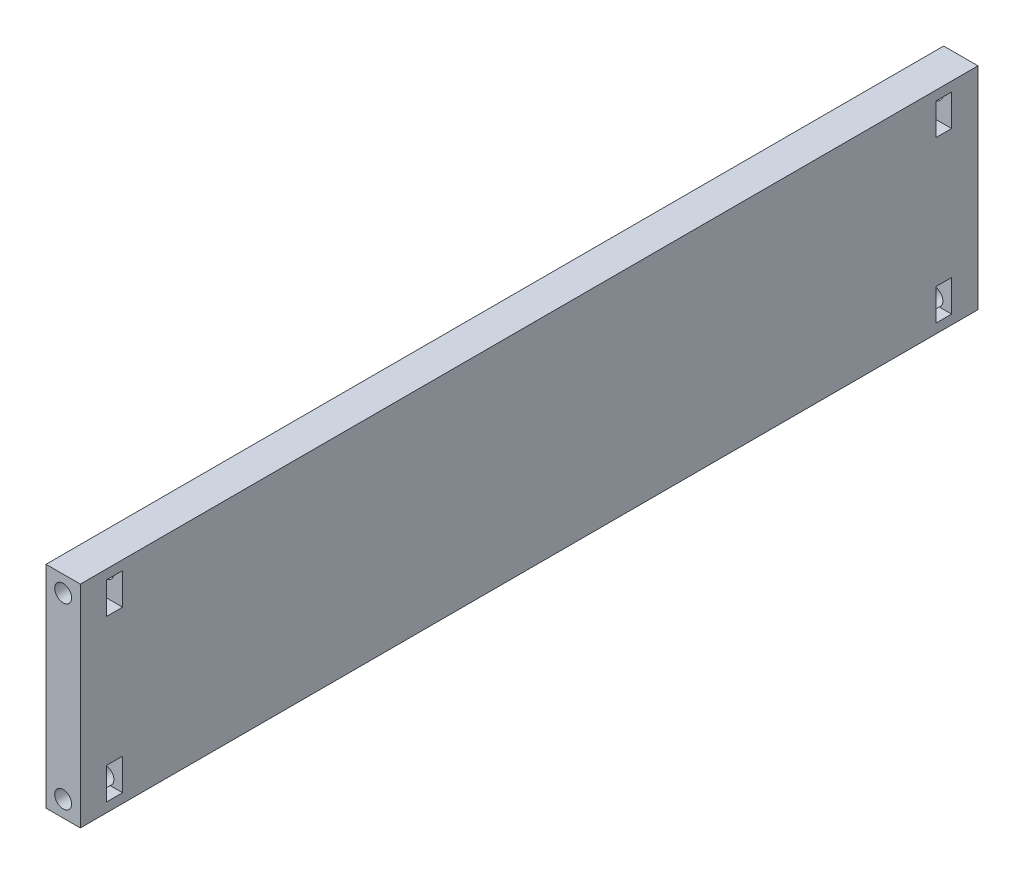
from build123d import *

# Parameters (mm, degrees)
SKETCH_1_W          = 170
SKETCH_1_H          = 40
SKETCH_1_W_2        = 3
SKETCH_1_H_2        = 6
EXTRUDE_2_DEPTH     = 6.5
SKETCH_4_R          = 1.6
CUT_EXTRUDE_1_DEPTH = 25
CUT_EXTRUDE_START   = -25
SKETCH_5_R          = 1.6
CUT_EXTRUDE_2_DEPTH = 25


with BuildPart() as part:
    # 草图1 → 凸台-拉伸2 (new body)
    with BuildSketch(Plane(origin=(0, 0, 0), x_dir=(0, 0, -1), z_dir=(1, 0, 0))):
        with Locations((85, 20)):
            Rectangle(SKETCH_1_W, SKETCH_1_H)
        with Locations((6.5, 4.78605941)):
            Rectangle(SKETCH_1_W_2, SKETCH_1_H_2, mode=Mode.SUBTRACT)
        with Locations((6.5, 35.21394059)):
            Rectangle(SKETCH_1_W_2, SKETCH_1_H_2, mode=Mode.SUBTRACT)
        with Locations((163.5, 4.78605941)):
            Rectangle(SKETCH_1_W_2, SKETCH_1_H_2, mode=Mode.SUBTRACT)
        with Locations((163.5, 35.21394059)):
            Rectangle(SKETCH_1_W_2, SKETCH_1_H_2, mode=Mode.SUBTRACT)
    extrude(amount=EXTRUDE_2_DEPTH)

    # 草图4 → 切除-拉伸1 (cut)
    with BuildSketch(Plane.XY):
        with Locations((3.25, 36.9)):
            Circle(SKETCH_4_R)
        with Locations((3.25, 3.1)):
            Circle(SKETCH_4_R)
    extrude(amount=-CUT_EXTRUDE_1_DEPTH, mode=Mode.SUBTRACT)

    # 草图5 → 切除-拉伸2 (cut)
    with BuildSketch(Plane(origin=(0, 0, -170), x_dir=(-1, 0, 0), z_dir=(0, 0, -1)).offset(CUT_EXTRUDE_START)):
        with Locations(Location((-3.25, 36.9, 0), (0, 0, 180))):
            Circle(SKETCH_5_R)
        with Locations(Location((-3.25, 3.1, 0), (0, 0, 180))):
            Circle(SKETCH_5_R)
    extrude(amount=CUT_EXTRUDE_2_DEPTH, mode=Mode.SUBTRACT)


solid = part.part
